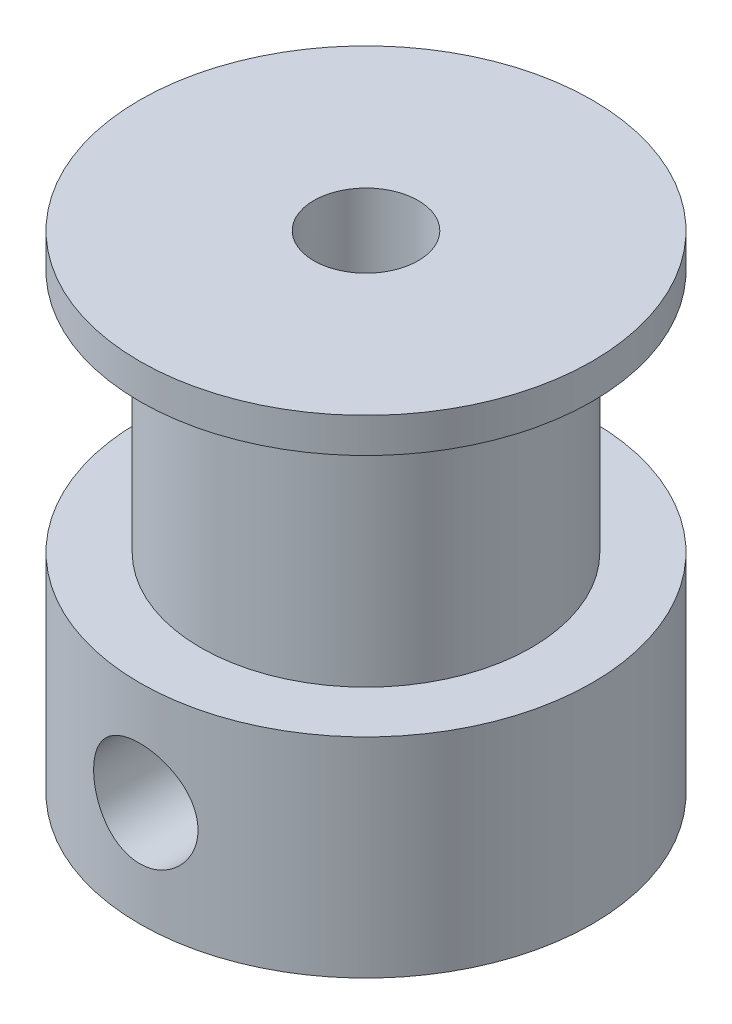
from build123d import *

# Parameters (mm, degrees)
CUT_EXTRUDE_1_REACH      = 22.18
CUT_EXTRUDE_1_END_RADIUS = 1.5


with BuildPart() as part:
    # 草图2 → 旋转1 (revolve)
    with BuildSketch(Plane.XY, mode=Mode.PRIVATE) as revolve_1_sk:
        Polygon((1.5, 14), (6.5, 14), (6.5, 13), (4.75, 13), (4.75, 6), (6.5, 6), (6.5, 0), (1.5, 0), align=None)
    revolve(revolve_1_sk.sketch.rotate(Axis((0, 66, 0), (0, -1, 0)), 90), axis=Axis((0, 66, 0), (0, -1, 0)))

    # 切除-拉伸1: up to this cylinder (the profile starts outside it)
    cut_extrude_1_end = Plane(origin=(0, 3, 0), z_dir=(0, 1, 0)) * Cylinder(CUT_EXTRUDE_1_END_RADIUS, 48.36, mode=Mode.PRIVATE)
    # 草图3 → 切除-拉伸1 (cut, up to the surface)
    with BuildSketch(Plane.XY.offset(6.5), mode=Mode.PRIVATE) as cut_extrude_1_sk1:
        with BuildLine():
            ThreePointArc((1.5, 3), (1.060660172, 4.060660172), (0, 4.5))
            Line((0, 4.5), (0, 1.5))
            ThreePointArc((0, 1.5), (1.060660172, 1.939339828), (1.5, 3))
        make_face()
    cut_extrude_1_tool1 = extrude(cut_extrude_1_sk1.sketch, amount=-CUT_EXTRUDE_1_REACH, mode=Mode.PRIVATE) - cut_extrude_1_end
    add(cut_extrude_1_tool1.solids().sort_by_distance((0.63662, 3, 6.5))[0], mode=Mode.SUBTRACT)
    # 草图3 → 切除-拉伸1 (cut, up to the surface)
    with BuildSketch(Plane.XY.offset(6.5), mode=Mode.PRIVATE) as cut_extrude_1_sk2:
        with BuildLine():
            Line((0, 1.5), (0, 4.5))
            ThreePointArc((0, 4.5), (-1.5, 3), (0, 1.5))
        make_face()
    cut_extrude_1_tool2 = extrude(cut_extrude_1_sk2.sketch, amount=-CUT_EXTRUDE_1_REACH, mode=Mode.PRIVATE) - cut_extrude_1_end
    add(cut_extrude_1_tool2.solids().sort_by_distance((-0.63662, 3, 6.5))[0], mode=Mode.SUBTRACT)
    # 草图3 → 切除-拉伸1 (cut, up to the surface)
    with BuildSketch(Plane.XY.offset(6.5), mode=Mode.PRIVATE) as cut_extrude_1_sk3:
        with BuildLine():
            ThreePointArc((1.5, 3), (1.060660172, 4.060660172), (0, 4.5))
            Line((0, 4.5), (0, 1.5))
            ThreePointArc((0, 1.5), (1.060660172, 1.939339828), (1.5, 3))
        make_face()
    cut_extrude_1_tool3 = extrude(cut_extrude_1_sk3.sketch, amount=-CUT_EXTRUDE_1_REACH, mode=Mode.PRIVATE) - cut_extrude_1_end
    add(cut_extrude_1_tool3.solids().sort_by_distance((0.63662, 3, 6.5))[0], mode=Mode.SUBTRACT)
    # 草图3 → 切除-拉伸1 (cut, up to the surface)
    with BuildSketch(Plane.XY.offset(6.5), mode=Mode.PRIVATE) as cut_extrude_1_sk4:
        with BuildLine():
            Line((0, 1.5), (0, 4.5))
            ThreePointArc((0, 4.5), (-1.5, 3), (0, 1.5))
        make_face()
    cut_extrude_1_tool4 = extrude(cut_extrude_1_sk4.sketch, amount=-CUT_EXTRUDE_1_REACH, mode=Mode.PRIVATE) - cut_extrude_1_end
    add(cut_extrude_1_tool4.solids().sort_by_distance((-0.63662, 3, 6.5))[0], mode=Mode.SUBTRACT)


solid = part.part
